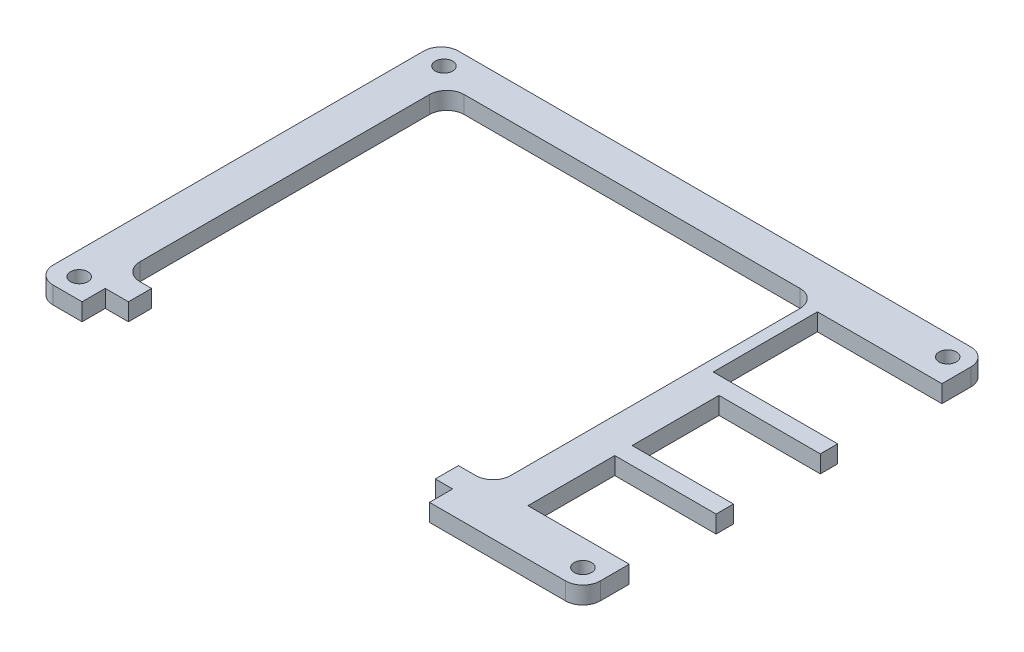
from build123d import *

# Parameters (mm, degrees)
SKETCH1_W           = 94.5
SKETCH1_H           = 70
BOSS_EXTRUDE1_DEPTH = 3
SKETCH3_R           = 1.5
CUT_EXTRUDE2_DEPTH  = 59.877521177
FILLET2_R           = 3
SKETCH5_W           = 64
SKETCH5_H           = 56
SKETCH5_W_2         = 21.5
SKETCH5_H_2         = 18
SKETCH5_W_3         = 17.5
SKETCH5_H_3         = 15
CUT_EXTRUDE3_DEPTH  = 59.877521177
FILLET3_R           = 3


with BuildPart() as part:
    # Sketch1 → Boss-Extrude1 (new body)
    with BuildSketch(Plane(origin=(0, 0, 0), x_dir=(1, 0, 0), z_dir=(0, 1, 0))):
        Rectangle(SKETCH1_W, SKETCH1_H)
    extrude(amount=BOSS_EXTRUDE1_DEPTH)

    # Sketch3 → Cut-Extrude2 (cut, through all)
    with BuildSketch(Plane(origin=(0, 3, 0), x_dir=(1, 0, 0), z_dir=(0, 1, 0))):
        with Locations(Location((43.75, 31.5, 0), (0, 0, 270))):
            Circle(SKETCH3_R)
        with Locations(Location((-43.25, 31.5, 0), (0, 0, 270))):
            Circle(SKETCH3_R)
        with Locations(Location((-43.25, -31.5, 0), (0, 0, 270))):
            Circle(SKETCH3_R)
        with Locations(Location((43.75, -31.5, 0), (0, 0, 270))):
            Circle(SKETCH3_R)
    extrude(amount=-CUT_EXTRUDE2_DEPTH, mode=Mode.SUBTRACT)

    # Fillet2
    fillet2_edges = [part.edges().sort_by_distance(p)[0] for p in [
        (47.25, 1.5, 35),
        (-47.25, 1.5, 35),
        (-47.25, 1.5, -35),
        (47.25, 1.5, -35),
    ]]
    fillet(fillet2_edges, radius=FILLET2_R)

    # Sketch5 → Cut-Extrude3 (cut, through all)
    with BuildSketch(Plane(origin=(0, 3, 0), x_dir=(1, 0, 0), z_dir=(0, 1, 0))):
        with Locations((-8.25, 1)):
            Rectangle(SKETCH5_W, SKETCH5_H)
        with Locations((36.5, 18)):
            Rectangle(SKETCH5_W_2, SKETCH5_H_2)
        with Locations((38.5, -1.5)):
            Rectangle(SKETCH5_W_3, SKETCH5_H_3)
        with Locations((38.5, -19.5)):
            Rectangle(SKETCH5_W_3, SKETCH5_H_3)
        Polygon((17.75, -27), (-35.25, -27), (-35.25, -31), (-39.25, -31), (-39.25, -35), (20.75, -35), (20.75, -31), (17.75, -31), align=None)
    extrude(amount=-CUT_EXTRUDE3_DEPTH, mode=Mode.SUBTRACT)

    # Fillet3
    fillet3_edges = [part.edges().sort_by_distance(p)[0] for p in [
        (-40.25, 1.5, 27),
        (-40.25, 1.5, -29),
        (23.75, 1.5, -29),
        (23.75, 1.5, 27),
    ]]
    fillet(fillet3_edges, radius=FILLET3_R)


solid = part.part
